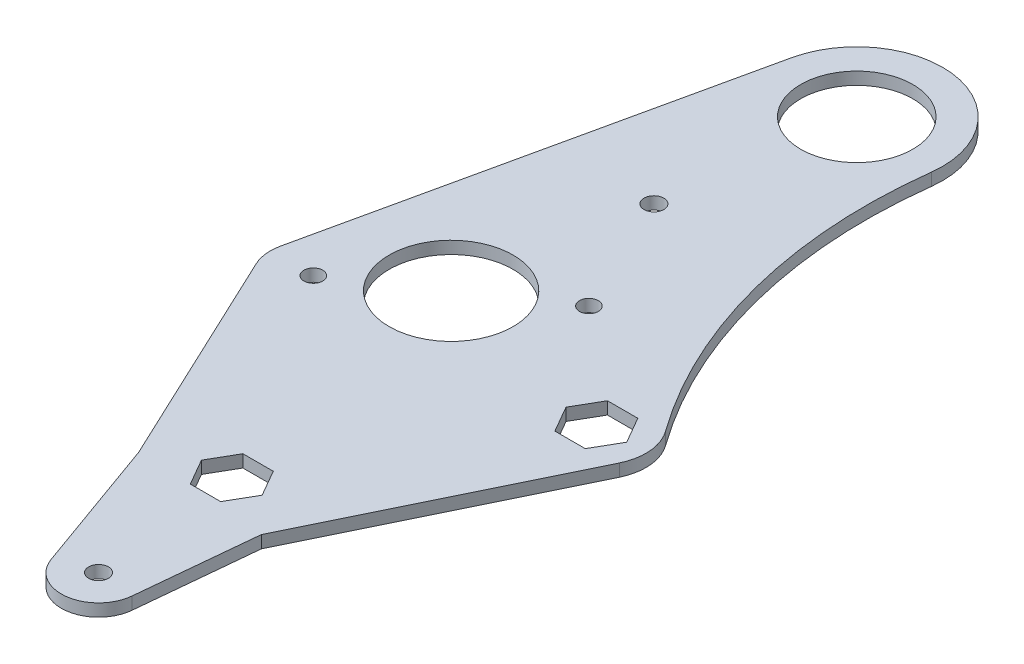
from build123d import *

# Parameters (mm, degrees)
SKETCH1_R           = 2.413
SKETCH1_R_2         = 15.875
SKETCH1_R_3         = 2.54
SKETCH1_R_4         = 14.3637
BOSS_EXTRUDE1_DEPTH = 3.175


with BuildPart() as part:
    # Sketch1 → Boss-Extrude1 (new body)
    with BuildSketch(Plane(origin=(0, 0, 0), x_dir=(1, 0, 0), z_dir=(0, 1, 0))):
        with BuildLine():
            ThreePointArc((21.817896039, -2.694898534), (3.719231857, 21.666803643), (-21.467646841, 4.735314647))
            Line((-21.467646841, 4.735314647), (-45.101906724, -102.41109111))
            ThreePointArc((-45.101906724, -102.41109111), (-45.29184394, -106.003215279), (-44.312542058, -109.464486724))
            Line((-44.312542058, -109.464486724), (-17.547919723, -166.315992152))
            Line((-17.547919723, -166.315992152), (-4.982896867, -201.336685807))
            ThreePointArc((-4.982896867, -201.336685807), (5.157188126, -207.572288673), (13.462550304, -199.044391753))
            Line((13.462550304, -199.044391753), (16.403973912, -168.878817283))
            Line((16.403973912, -168.878817283), (46.351547638, -107.142924236))
            ThreePointArc((46.351547638, -107.142924236), (47.577872684, -100.506925054), (45.231649184, -94.179556443))
            ThreePointArc((45.231649184, -94.179556443), (24.882907581, -50.648948002), (21.817896039, -2.694898534))
        make_face()
        Polygon((-7.772289324, -160.02), (-3.886144662, -153.289), (3.886144662, -153.289), (7.772289324, -160.02), (3.886144662, -166.751), (-3.886144662, -166.751), align=None, mode=Mode.SUBTRACT)
        with Locations(Location((-34.362191084, -104.780048134, 0), (0, 0, 270))):
            Circle(SKETCH1_R, mode=Mode.SUBTRACT)
        with Locations(Location((-13.34845818, -90.511795634, 0), (0, 0, 270))):
            Circle(SKETCH1_R_2, mode=Mode.SUBTRACT)
        with Locations(Location((7.665274725, -76.243543134, 0), (0, 0, 270))):
            Circle(SKETCH1_R, mode=Mode.SUBTRACT)
        Polygon((42.697289324, -101.6), (38.811144662, -108.331), (31.038855338, -108.331), (27.152710676, -101.6), (31.038855338, -94.869), (38.811144662, -94.869), align=None, mode=Mode.SUBTRACT)
        with Locations(Location((-6.67422909, -45.255897817, 0), (0, 0, 270))):
            Circle(SKETCH1_R_3, mode=Mode.SUBTRACT)
        with Locations(Location((0, 0, 0), (0, 0, 270))):
            Circle(SKETCH1_R_4, mode=Mode.SUBTRACT)
        with Locations(Location((3.982512071, -198.12, 0), (0, 0, 270))):
            Circle(SKETCH1_R_3, mode=Mode.SUBTRACT)
    extrude(amount=BOSS_EXTRUDE1_DEPTH)


solid = part.part
